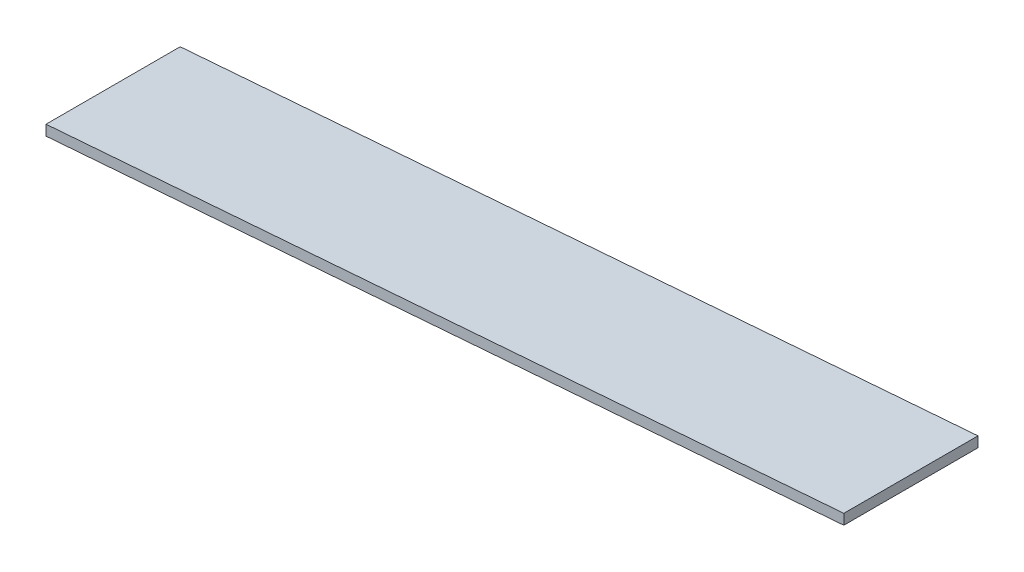
from build123d import *

# Parameters (mm, degrees)
EXTRUDE_1_DEPTH = 6.5


with BuildPart() as part:
    # 草圖1 → 填料-伸長1 (new, symmetric)
    with BuildSketch(Plane.XY):
        Polygon((0, 0), (77.3, 6.002198858), (77.3, 7.005208943), (0, 1.003010084), align=None)
    extrude(amount=EXTRUDE_1_DEPTH, both=True)


solid = part.part
